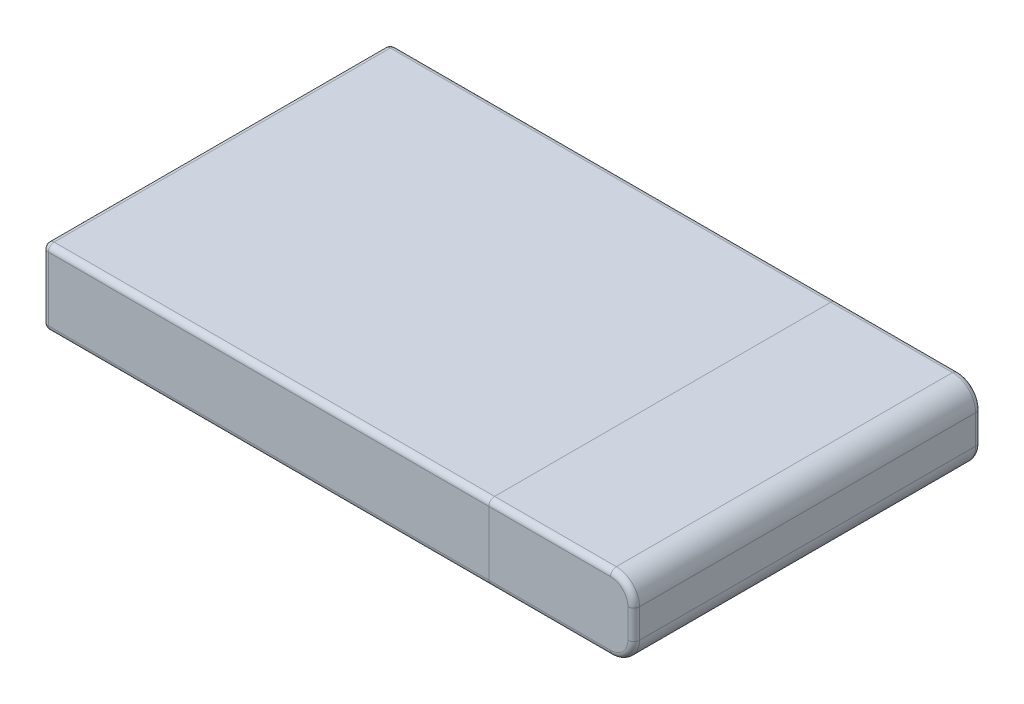
from build123d import *

# Parameters (mm, degrees)
BOSS_EXTRUDE1_DEPTH      = 3.25
BOSS_EXTRUDE1_DEPTH_BACK = 3.25
SKETCH1_W                = 38.5
SKETCH1_H                = 30
SKETCH4_W                = 30
SKETCH4_H                = 6.5
BOSS_EXTRUDE4_DEPTH      = 12.5
FILLET1_R                = 2
FILLET3_R                = 0.5
FILLET4_R                = 0.5


with BuildPart() as part:
    # Sketch1 → Boss-Extrude1 (new, two sides: drawn at the far end of the back side and taken through both)
    with BuildSketch(Plane(origin=(0, 0, 0), x_dir=(1, 0, 0), z_dir=(0, 1, 0)).offset(-BOSS_EXTRUDE1_DEPTH_BACK)):
        Rectangle(SKETCH1_W, SKETCH1_H)
    extrude(amount=BOSS_EXTRUDE1_DEPTH + BOSS_EXTRUDE1_DEPTH_BACK)

    # Fillet4
    fillet4_edges = [part.edges().sort_by_distance(p)[0] for p in [
        (-19.25, 0, 15),
        (-19.25, 3.25, 0),
        (-19.25, 0, -15),
        (-19.25, -3.25, 0),
        (0, -3.25, -15),
        (0, 3.25, -15),
        (0, -3.25, 15),
        (0, 3.25, 15),
    ]]
    fillet(fillet4_edges, radius=FILLET4_R)


with BuildPart() as body_2:
    # Sketch4 → Boss-Extrude4 (new body)
    with BuildSketch(Plane(origin=(19.25, 0, 0), x_dir=(0, 0, -1), z_dir=(1, 0, 0))):
        Rectangle(SKETCH4_W, SKETCH4_H)
    extrude(amount=BOSS_EXTRUDE4_DEPTH)

    # Fillet1
    fillet1_edges = [body_2.edges().sort_by_distance(p)[0] for p in [
        (31.75, -3.25, 0),
        (31.75, 3.25, 0),
    ]]
    fillet(fillet1_edges, radius=FILLET1_R)

    # Fillet3
    fillet3_edges = [body_2.edges().sort_by_distance(p)[0] for p in [
        (24.5, -3.25, 15),
        (31.164213562, -2.664213562, 15),
        (31.75, 0, 15),
        (31.164213562, 2.664213562, 15),
        (24.5, -3.25, -15),
        (31.164213562, -2.664213562, -15),
        (31.75, 0, -15),
        (31.164213562, 2.664213562, -15),
        (24.5, 3.25, 15),
        (24.5, 3.25, -15),
    ]]
    fillet(fillet3_edges, radius=FILLET3_R)


solid = Compound([part.part, body_2.part])
